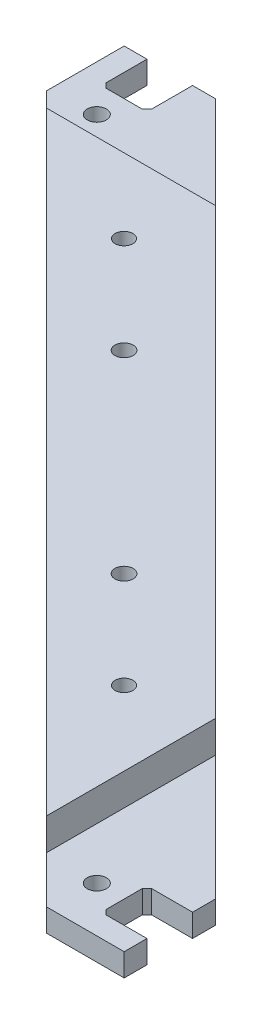
from build123d import *

# Parameters (mm, degrees)
MAIN_BASE_EXTRUDE_DEPTH       = 12
SKETCH3_W                     = 47.3
SKETCH3_H                     = 27.3
SKETCH3_W_2                   = 27.3
SKETCH3_H_2                   = 47.3
TRACK_SEAT_CUT_DEPTH          = 7
SKETCH2_R                     = 2.1
TRACK_CONNECT_HOLES_DEPTH     = 244.540551038
WALL_SPACED_HOLES_DEPTH       = 244.540551038
WALL_SPACED_HOLES_DEPTH_BACK  = 244.540551038
SKETCH5_R                     = 1.95
SKETCH5_R_2                   = 2
SKETCH9_W                     = 10
SKETCH9_H                     = 10
WIRE_PASSTHROUGH_CUT_DEPTH    = 244.345433489
WIRE_PASSTHROUGH_CHAMFER_SIZE = 1


with BuildPart() as part:
    # Sketch1 → Main Base Extrude (new body)
    with BuildSketch(Plane(origin=(0, 0, 0), x_dir=(1, 0, 0), z_dir=(0, 1, 0))):
        Polygon((0, 0), (20, 0), (172, -152), (172, -172), (155, -172), (0, -17), align=None)
    extrude(amount=MAIN_BASE_EXTRUDE_DEPTH)

    # Sketch3 → Track Seat Cut (cut)
    with BuildSketch(Plane(origin=(0, 12, 0), x_dir=(1, 0, 0), z_dir=(0, 1, 0))):
        with Locations((23.65, -13.65)):
            Rectangle(SKETCH3_W, SKETCH3_H)
        with Locations((158.35, -148.35)):
            Rectangle(SKETCH3_W_2, SKETCH3_H_2)
    extrude(amount=-TRACK_SEAT_CUT_DEPTH, mode=Mode.SUBTRACT)

    # Sketch2 → Track Connect Holes (cut, through all)
    with BuildSketch(Plane(origin=(0, 12, 0), x_dir=(1, 0, 0), z_dir=(0, 1, 0))):
        with Locations(Location((10, -16, 0), (0, 0, 270))):
            Circle(SKETCH2_R)
        with Locations(Location((156, -162, 0), (0, 0, 270))):
            Circle(SKETCH2_R)
    extrude(amount=-TRACK_CONNECT_HOLES_DEPTH, mode=Mode.SUBTRACT)

    # Sketch5 → Wall Spaced Holes (cut, two sides: drawn at the far end of the back side and taken through both)
    with BuildSketch(Plane(origin=(0, 0, 0), x_dir=(1, 0, 0), z_dir=(0, 1, 0)).offset(-WALL_SPACED_HOLES_DEPTH_BACK)):
        with Locations(Location((128.411688245, -128.441125497, 0), (0, 0, 270))):
            Circle(SKETCH5_R)
        with Locations(Location((107.19848481, -107.227922061, 0), (0, 0, 270))):
            Circle(SKETCH5_R_2)
        with Locations(Location((43.558874503, -43.588311755, 0), (0, 0, 90))):
            Circle(SKETCH5_R)
        with Locations(Location((64.772077939, -64.80151519, 0), (0, 0, 90))):
            Circle(SKETCH5_R_2)
    extrude(amount=WALL_SPACED_HOLES_DEPTH + WALL_SPACED_HOLES_DEPTH_BACK, mode=Mode.SUBTRACT)

    # Sketch9 → Wire Passthrough Cut (cut, through all)
    with BuildSketch(Plane(origin=(0, 5, 0), x_dir=(1, 0, 0), z_dir=(0, 1, 0))):
        with Locations((10, -5)):
            Rectangle(SKETCH9_W, SKETCH9_H)
        with Locations((167, -162)):
            Rectangle(SKETCH9_W, SKETCH9_H)
    extrude(amount=-WIRE_PASSTHROUGH_CUT_DEPTH, mode=Mode.SUBTRACT)

    # Wire Passthrough Chamfer
    wire_passthrough_chamfer_edges = [part.edges().sort_by_distance(p)[0] for p in [
        (5, 2.5, 10),
        (15, 2.5, 10),
        (162, 2.5, 167),
        (162, 2.5, 157),
    ]]
    chamfer(wire_passthrough_chamfer_edges, length=WIRE_PASSTHROUGH_CHAMFER_SIZE)


solid = part.part
